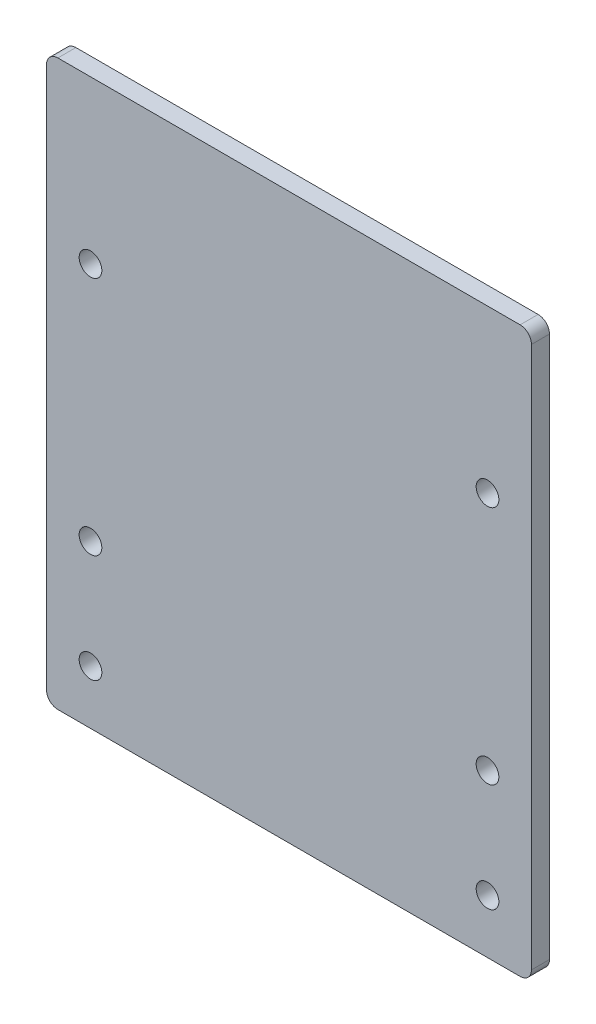
from build123d import *

# Parameters (mm, degrees)
SKETCH1_R           = 2
BOSS_EXTRUDE1_DEPTH = 3.175


with BuildPart() as part:
    # Sketch1 → Boss-Extrude1 (new body)
    with BuildSketch(Plane.XY):
        with BuildLine():
            Line((-40.75, 0), (40.75, 0))
            ThreePointArc((40.75, 0), (42.164213562, -0.585786438), (42.75, -2))
            Line((42.75, -2), (42.75, -97.5))
            ThreePointArc((42.75, -97.5), (42.164213562, -98.914213562), (40.75, -99.5))
            Line((40.75, -99.5), (-40.75, -99.5))
            ThreePointArc((-40.75, -99.5), (-42.164213562, -98.914213562), (-42.75, -97.5))
            Line((-42.75, -97.5), (-42.75, -2))
            ThreePointArc((-42.75, -2), (-42.164213562, -0.585786438), (-40.75, 0))
        make_face()
        with Locations((35, -89.975)):
            Circle(SKETCH1_R, mode=Mode.SUBTRACT)
        with Locations((-35, -89.975)):
            Circle(SKETCH1_R, mode=Mode.SUBTRACT)
        with Locations((35, -70.925)):
            Circle(SKETCH1_R, mode=Mode.SUBTRACT)
        with Locations((35, -28.58)):
            Circle(SKETCH1_R, mode=Mode.SUBTRACT)
        with Locations((-35, -70.92)):
            Circle(SKETCH1_R, mode=Mode.SUBTRACT)
        with Locations((-35, -28.58)):
            Circle(SKETCH1_R, mode=Mode.SUBTRACT)
    extrude(amount=BOSS_EXTRUDE1_DEPTH)


solid = part.part
